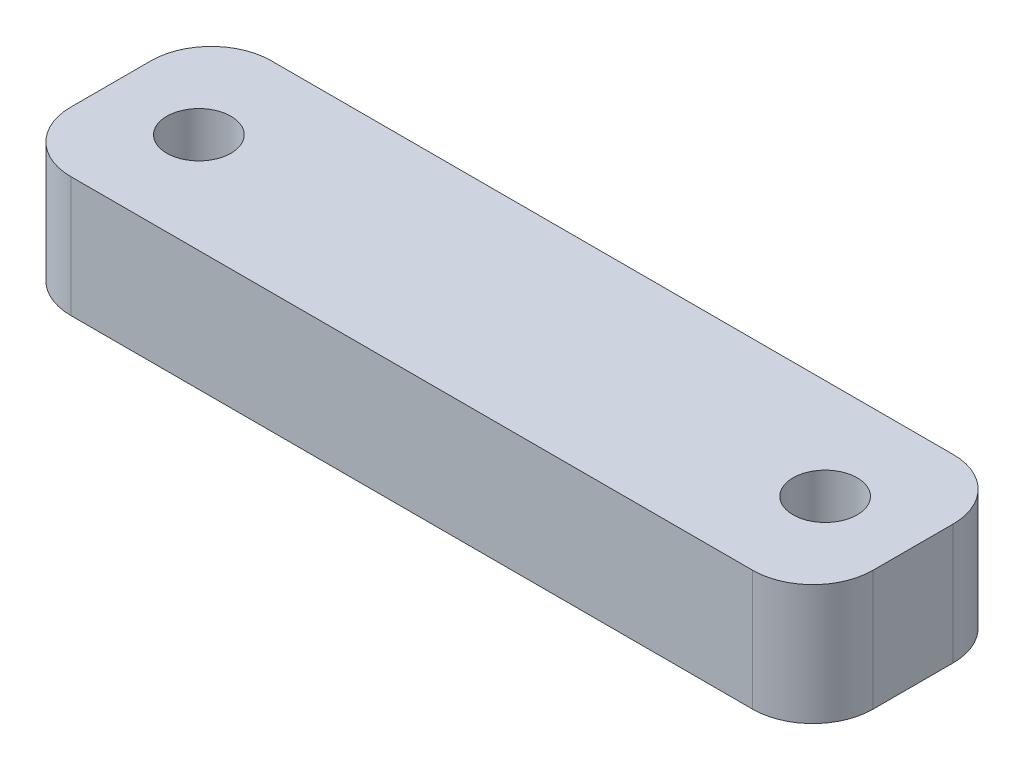
from build123d import *

# Parameters (mm, degrees)
SKETCH_1_W          = 40
SKETCH_1_H          = 10
EXTRUDE_1_DEPTH     = 6
CUT_EXTRUDE_1_REACH = 23.471
SKETCH_2_R          = 1.6
FILLET_1_R          = 3


with BuildPart() as part:
    # 草图1 → 凸台-拉伸1 (new body)
    with BuildSketch(Plane(origin=(0, 0, 0), x_dir=(1, 0, 0), z_dir=(0, 1, 0))):
        Rectangle(SKETCH_1_W, SKETCH_1_H)
    extrude(amount=EXTRUDE_1_DEPTH)

    # 草图2 → 切除-拉伸1 (cut, up to next)
    with BuildSketch(Plane(origin=(0, 6, 0), x_dir=(1, 0, 0), z_dir=(0, 1, 0)), mode=Mode.PRIVATE) as cut_extrude_1_sk1:
        with Locations(Location((-15.612495, 0, 0), (0, 0, 270))):
            Circle(SKETCH_2_R)
    cut_extrude_1_tool1 = extrude(cut_extrude_1_sk1.sketch, amount=-CUT_EXTRUDE_1_REACH, mode=Mode.PRIVATE) & part.part
    # 草图2 → 切除-拉伸1 (cut, up to next)
    with BuildSketch(Plane(origin=(0, 6, 0), x_dir=(1, 0, 0), z_dir=(0, 1, 0)), mode=Mode.PRIVATE) as cut_extrude_1_sk2:
        with Locations(Location((15.612495, 0, 0), (0, 0, 270))):
            Circle(SKETCH_2_R)
    cut_extrude_1_tool2 = extrude(cut_extrude_1_sk2.sketch, amount=-CUT_EXTRUDE_1_REACH, mode=Mode.PRIVATE) & part.part
    add(cut_extrude_1_tool1.solids().sort_by_distance((-15.612495, 6, 0))[0], mode=Mode.SUBTRACT)
    add(cut_extrude_1_tool2.solids().sort_by_distance((15.612495, 6, 0))[0], mode=Mode.SUBTRACT)

    # 圆角1
    fillet_1_edges = [part.edges().sort_by_distance(p)[0] for p in [
        (20, 3, 5),
        (-20, 3, 5),
        (-20, 3, -5),
        (20, 3, -5),
    ]]
    fillet(fillet_1_edges, radius=FILLET_1_R)


solid = part.part
